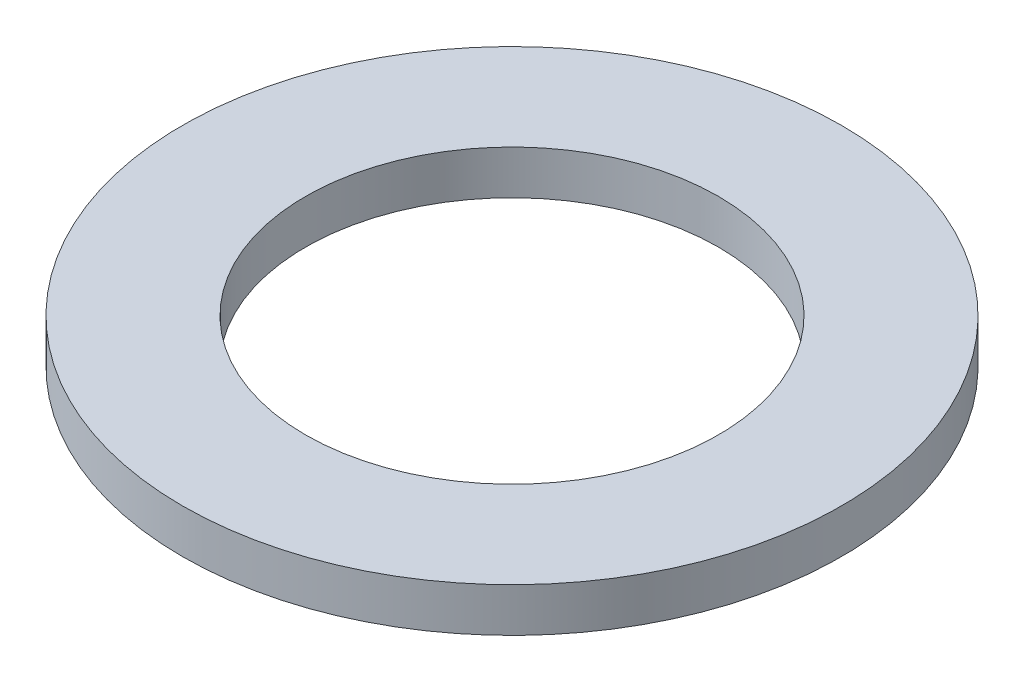
from build123d import *

# Parameters (mm, degrees)
ESQUISSE2_R        = 7.5
ESQUISSE2_R_2      = 4.7
BOSS_EXTRU_1_DEPTH = 1


with BuildPart() as part:
    # Esquisse2 → Boss.-Extru.1 (new body)
    with BuildSketch(Plane(origin=(0, 0, 0), x_dir=(1, 0, 0), z_dir=(0, 1, 0))):
        with Locations(Location((0, 0, 0), (0, 0, 270))):
            Circle(ESQUISSE2_R)
        with Locations(Location((0, 0, 0), (0, 0, 270))):
            Circle(ESQUISSE2_R_2, mode=Mode.SUBTRACT)
    extrude(amount=BOSS_EXTRU_1_DEPTH)


solid = part.part
